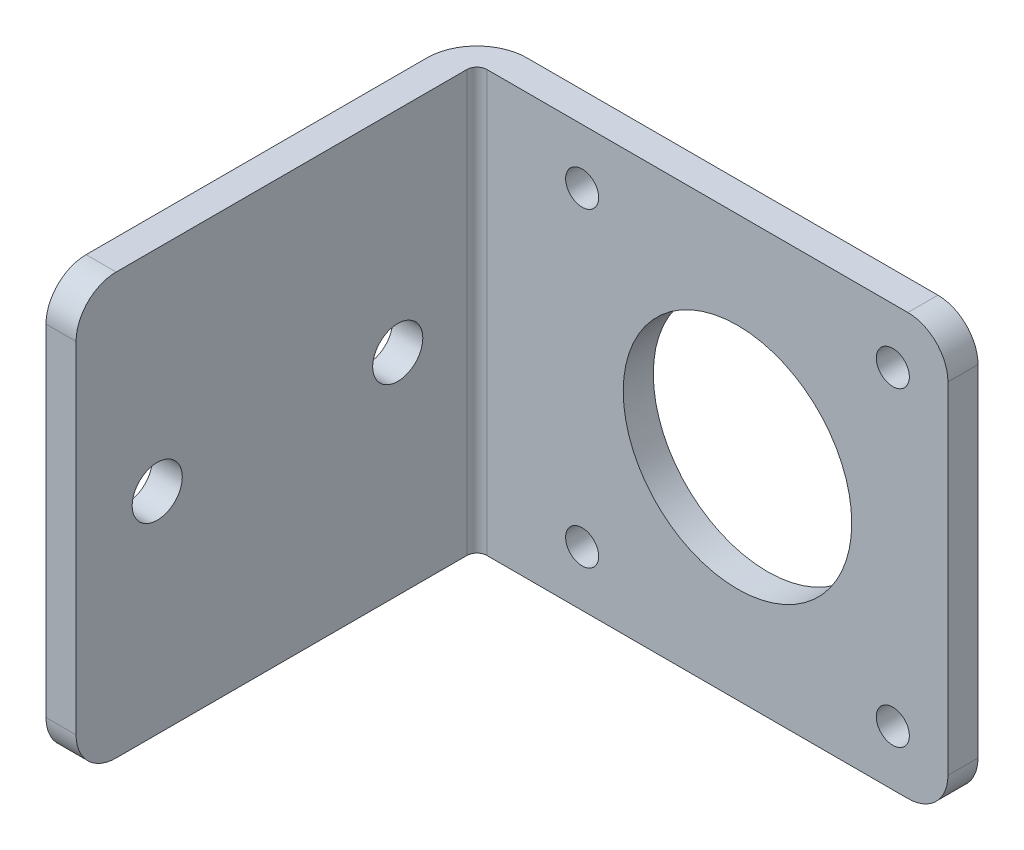
from build123d import *

# Parameters (mm, degrees)
EXTRUDE_THIN1_DEPTH = 21
SKETCH2_R           = 11.4
SKETCH2_R_2         = 1.65
CUT_EXTRUDE1_DEPTH  = 68.386942355
SKETCH3_R           = 2.5
CUT_EXTRUDE2_DEPTH  = 68.074585351
FILLET1_R           = 4
FILLET2_R           = 5
FILLET3_R           = 1


with BuildPart() as part:
    # Sketch1 → Extrude-Thin1 (new, symmetric)
    with BuildSketch(Plane(origin=(0, 0, 0), x_dir=(1, 0, 0), z_dir=(0, 1, 0))):
        Polygon((0, -43), (0, 0), (50, 0), (50, -3), (3, -3), (3, -43), align=None)
    extrude(amount=EXTRUDE_THIN1_DEPTH, both=True)

    # Sketch2 → Cut-Extrude1 (cut, through all)
    with BuildSketch(Plane.XY.offset(3)):
        with Locations((29, 0)):
            Circle(SKETCH2_R)
        with Locations((13.5, 15.5)):
            Circle(SKETCH2_R_2)
        with Locations((44.5, 15.5)):
            Circle(SKETCH2_R_2)
        with Locations((13.5, -15.5)):
            Circle(SKETCH2_R_2)
        with Locations((44.5, -15.5)):
            Circle(SKETCH2_R_2)
    extrude(amount=-CUT_EXTRUDE1_DEPTH, mode=Mode.SUBTRACT)

    # Sketch3 → Cut-Extrude2 (cut, through all)
    with BuildSketch(Plane(origin=(3, 0, 0), x_dir=(0, 0, -1), z_dir=(1, 0, 0))):
        with Locations((-34.9, 0)):
            Circle(SKETCH3_R)
        with Locations((-10.9, 0)):
            Circle(SKETCH3_R)
    extrude(amount=-CUT_EXTRUDE2_DEPTH, mode=Mode.SUBTRACT)

    # Fillet1
    fillet1_edges = [part.edges().sort_by_distance(p)[0] for p in [
        (1.5, 21, 43),
        (1.5, -21, 43),
        (50, -21, 1.5),
        (50, 21, 1.5),
    ]]
    fillet(fillet1_edges, radius=FILLET1_R)

    # Fillet2
    fillet2_edges = [part.edges().sort_by_distance(p)[0] for p in [
        (0, 0, 0),
    ]]
    fillet(fillet2_edges, radius=FILLET2_R)

    # Fillet3
    fillet3_edges = [part.edges().sort_by_distance(p)[0] for p in [
        (3, 0, 3),
    ]]
    fillet(fillet3_edges, radius=FILLET3_R)


solid = part.part
